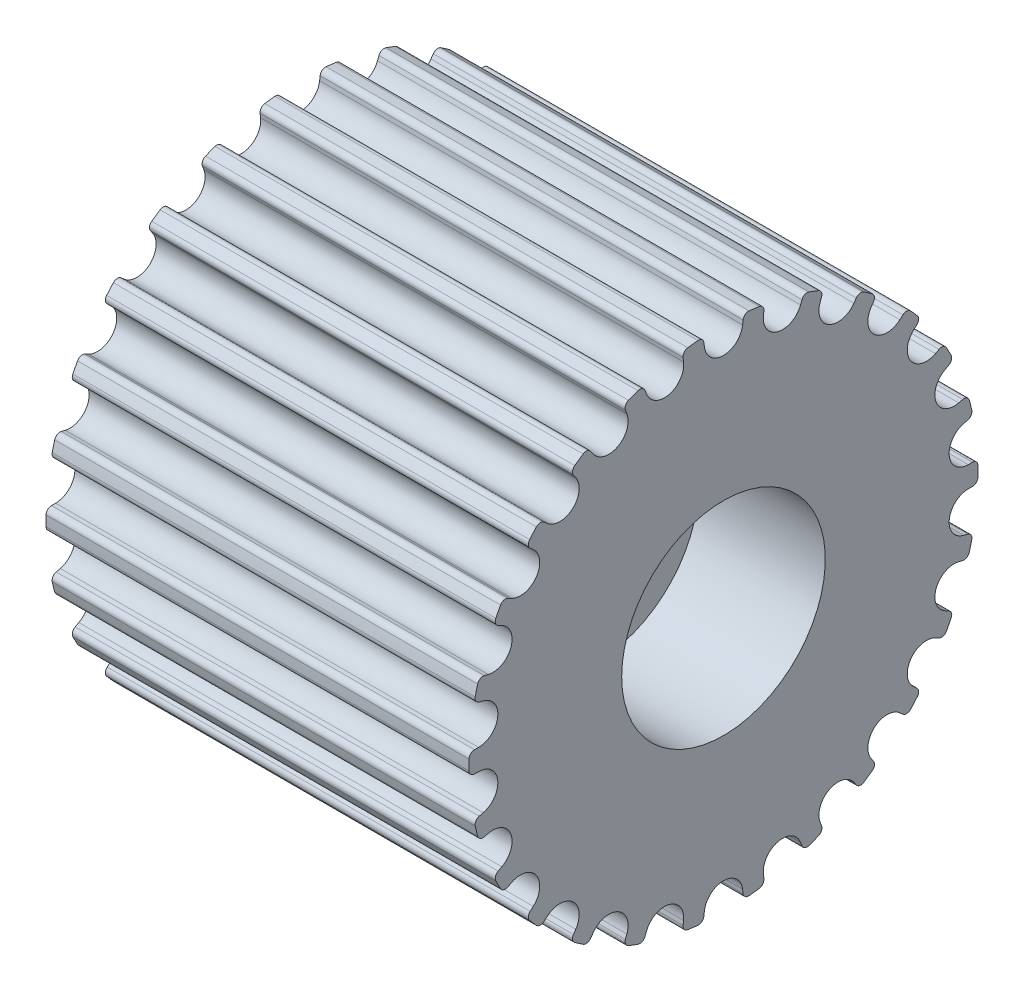
from build123d import *

# Parameters (mm, degrees)
CHAMFER_1_SIZE           = 1
SKETCH_4_W               = 2
SKETCH_4_H               = 1.217579536
CUT_EXTRUDE_1_DEPTH      = 27.260889398
CUT_EXTRUDE_2_REACH      = 28.261
PATTERN_CIRCULAR_3_COUNT = 26


with BuildPart() as part:
    # 草图1 → 旋转1 (revolve)
    with BuildSketch(Plane.XY):
        Polygon((0, 2.4068), (0, 12.034), (20, 12.034), (20, 4.8136), (14, 4.8136), (14, 2.4068), align=None)
    revolve(axis=Axis((0, 0, 0), (1, 0, 0)))

    # 倒角1
    chamfer_1_edges = [part.edges().sort_by_distance(p)[0] for p in [
        (14, -2.4068, 0),
        (0, -2.4068, 0),
    ]]
    chamfer(chamfer_1_edges, length=CHAMFER_1_SIZE)

    # 草图4 → 切除-拉伸1 (cut, through all)
    with BuildSketch(Plane.ZY):
        with Locations((0, 2.798010232)):
            Rectangle(SKETCH_4_W, SKETCH_4_H)
    extrude(amount=-CUT_EXTRUDE_1_DEPTH, mode=Mode.SUBTRACT)

    # 草图6 → 切除-拉伸2 (cut, up to next)
    with BuildSketch(Plane(origin=(0, 0, 0), x_dir=(0, 0, -1), z_dir=(1, 0, 0)), mode=Mode.PRIVATE) as cut_extrude_2_sk1:
        with BuildLine():
            Line((0.926890803, 11.745906569), (0.903216998, 11.553098898))
            ThreePointArc((0.903216998, 11.553098898), (0, 10.754), (-0.903216998, 11.553098898))
            Line((-0.903216998, 11.553098898), (-0.926890803, 11.745906569))
            ThreePointArc((-0.926890803, 11.745906569), (-1.022701751, 11.917382042), (-1.211119588, 11.972900457))
            ThreePointArc((-1.211119588, 11.972900457), (-1.340388876, 11.959118432), (-1.469501738, 11.94394075))
            Line((-1.469501738, 11.94394075), (-1.666149726, 13.545510092))
            ThreePointArc((-1.666149726, 13.545510092), (0, 13.647596806), (1.666149726, 13.545510092))
            Line((1.666149726, 13.545510092), (1.469501738, 11.94394075))
            ThreePointArc((1.469501738, 11.94394075), (1.340388876, 11.959118432), (1.211119588, 11.972900457))
            ThreePointArc((1.211119588, 11.972900457), (1.022701751, 11.917382042), (0.926890803, 11.745906569))
        make_face()
    cut_extrude_2_tool1 = extrude(cut_extrude_2_sk1.sketch, amount=CUT_EXTRUDE_2_REACH, mode=Mode.PRIVATE) & part.part
    cut_extrude_2 = cut_extrude_2_tool1.solids().sort_by_distance((0, 12.444283, 0))[0]
    add(cut_extrude_2, mode=Mode.SUBTRACT)

    # 阵列(圆周)3: 切除-拉伸2 ×26 about axis
    pattern_circular_3_axis = Axis((-1.4, 0, 0), (1, 0, 0))
    for i in range(1, PATTERN_CIRCULAR_3_COUNT):
        add(cut_extrude_2.rotate(pattern_circular_3_axis, i * 360 / PATTERN_CIRCULAR_3_COUNT), mode=Mode.SUBTRACT)


solid = part.part
